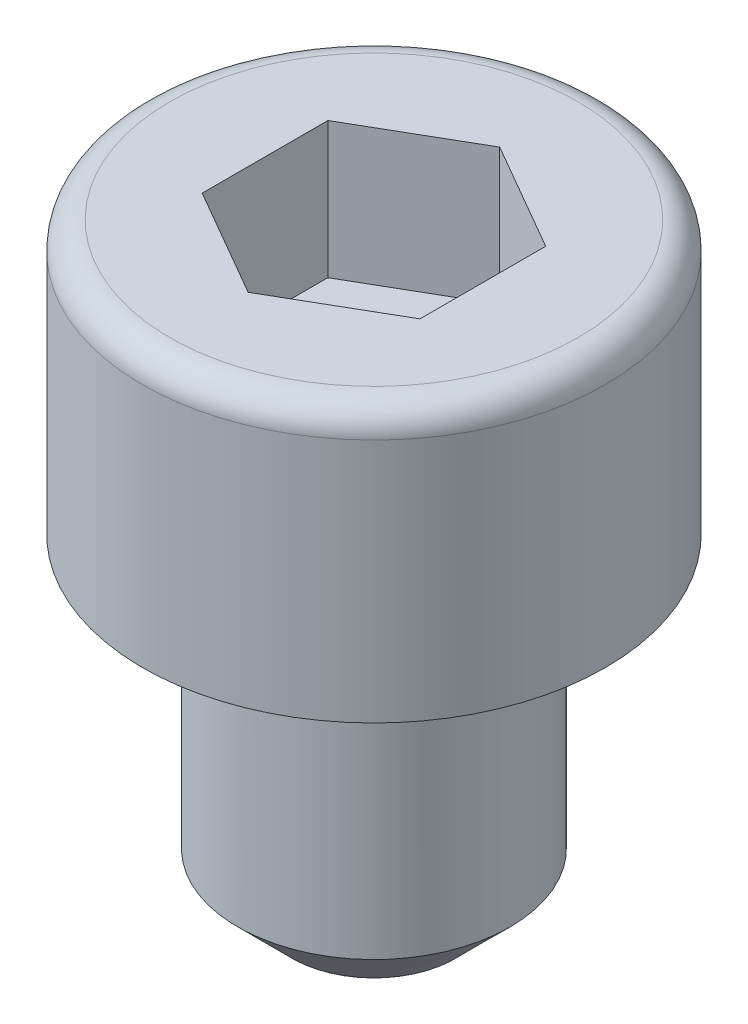
from build123d import *

# Parameters (mm, degrees)
CUT_EXTRUDE1_DEPTH = 2.5
FILLET1_R          = 0.5
CHAMFER1_SIZE      = 1


with BuildPart() as part:
    # Sketch1 → Revolve1 (revolve)
    with BuildSketch(Plane.XY, mode=Mode.PRIVATE) as revolve1_sk:
        Polygon((0, 0), (0, 11), (-4.25, 11), (-4.25, 6), (-2.5, 6), (-2.5, 0), align=None)
    revolve(revolve1_sk.sketch.rotate(Axis((0, -1000, 0), (0, 1, 0)), 180), axis=Axis((0, -1000, 0), (0, 1, 0)))

    # Sketch2 → Cut-Extrude1 (cut)
    with BuildSketch(Plane(origin=(0, 11, 0), x_dir=(1, 0, 0), z_dir=(0, 1, 0))):
        Polygon((0, 2.309401077), (-2, 1.154700538), (-2, -1.154700538), (0, -2.309401077), (2, -1.154700538), (2, 1.154700538), align=None)
    extrude(amount=-CUT_EXTRUDE1_DEPTH, mode=Mode.SUBTRACT)

    # Fillet1
    fillet1_edges = [part.edges().sort_by_distance(p)[0] for p in [
        (-4.25, 11, 0),
    ]]
    fillet(fillet1_edges, radius=FILLET1_R)

    # Chamfer1
    chamfer1_edges = [part.edges().sort_by_distance(p)[0] for p in [
        (-2.5, 0, 0),
    ]]
    chamfer(chamfer1_edges, length=CHAMFER1_SIZE)


solid = part.part
